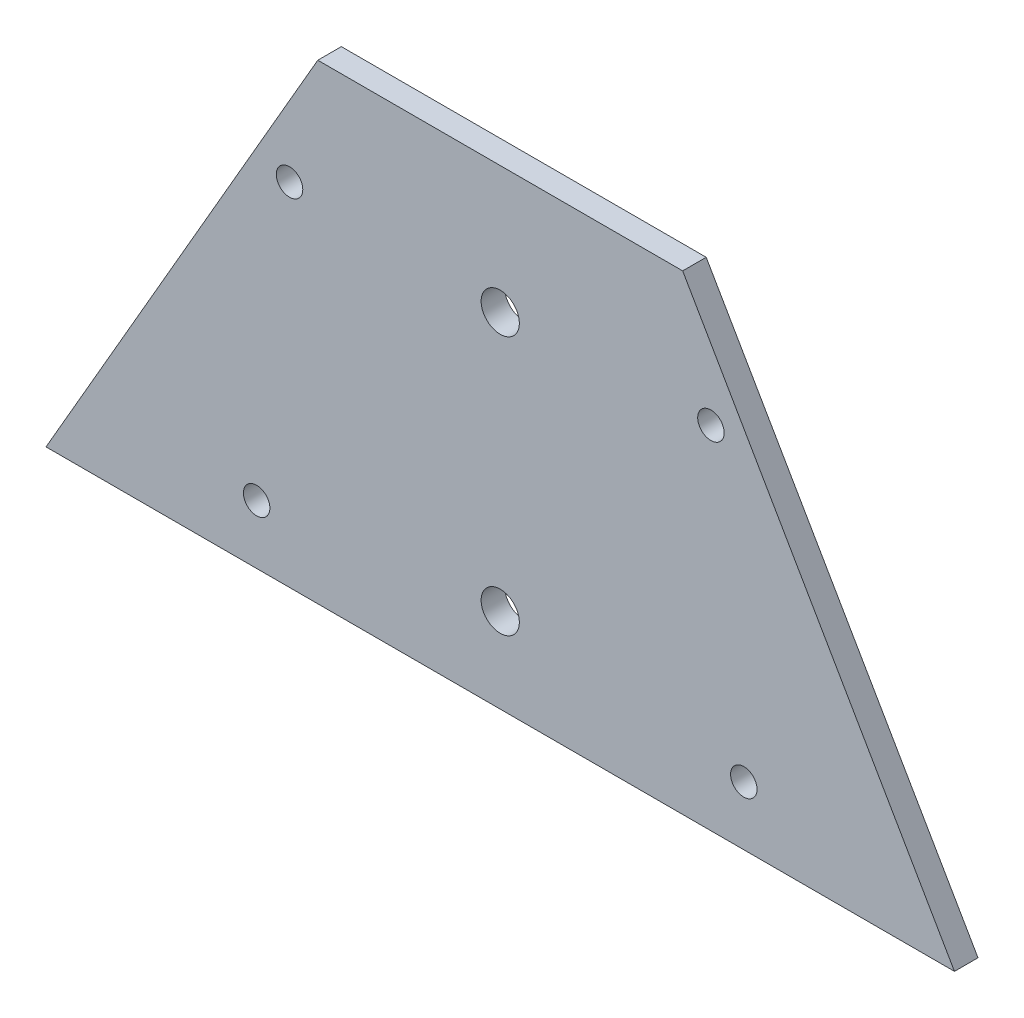
from build123d import *

# Parameters (mm, degrees)
BOSS_EXTRUDE1_DEPTH     = 6.35
F_3_8_CLEARANCE_HOLE1_D = 10.31748
F_1_4_CLEARANCE_HOLE1_D = 7.14248


with BuildPart() as part:
    # Sketch1 → Boss-Extrude1 (new body)
    with BuildSketch(Plane.XY):
        Polygon((-49.2125, 113.079516789), (49.2125, 113.079516789), (122.535984187, -13.920483211), (-122.535984187, -13.920483211), align=None)
    extrude(amount=BOSS_EXTRUDE1_DEPTH)

    # 3/8 Clearance Hole1 (through all)
    with Locations(Plane.XY.offset(6.35)):
        with Locations((0, 78.805444667), (0, 8.955444667)):
            Hole(F_3_8_CLEARANCE_HOLE1_D / 2)

    # 1/4 Clearance Hole1 (through all)
    with Locations(Plane.XY.offset(6.35)):
        with Locations((65.710283942, 1.954516789), (56.838608029, 80.820710219)):
            f_1_4_clearance_hole1 = Hole(F_1_4_CLEARANCE_HOLE1_D / 2)

    # Mirror1: 1/4 Clearance Hole1 across plane
    add(f_1_4_clearance_hole1.mirror(Plane(origin=(0, 0, 0), x_dir=(0, 0, 1), z_dir=(1, 0, 0))), mode=Mode.SUBTRACT)


solid = part.part
